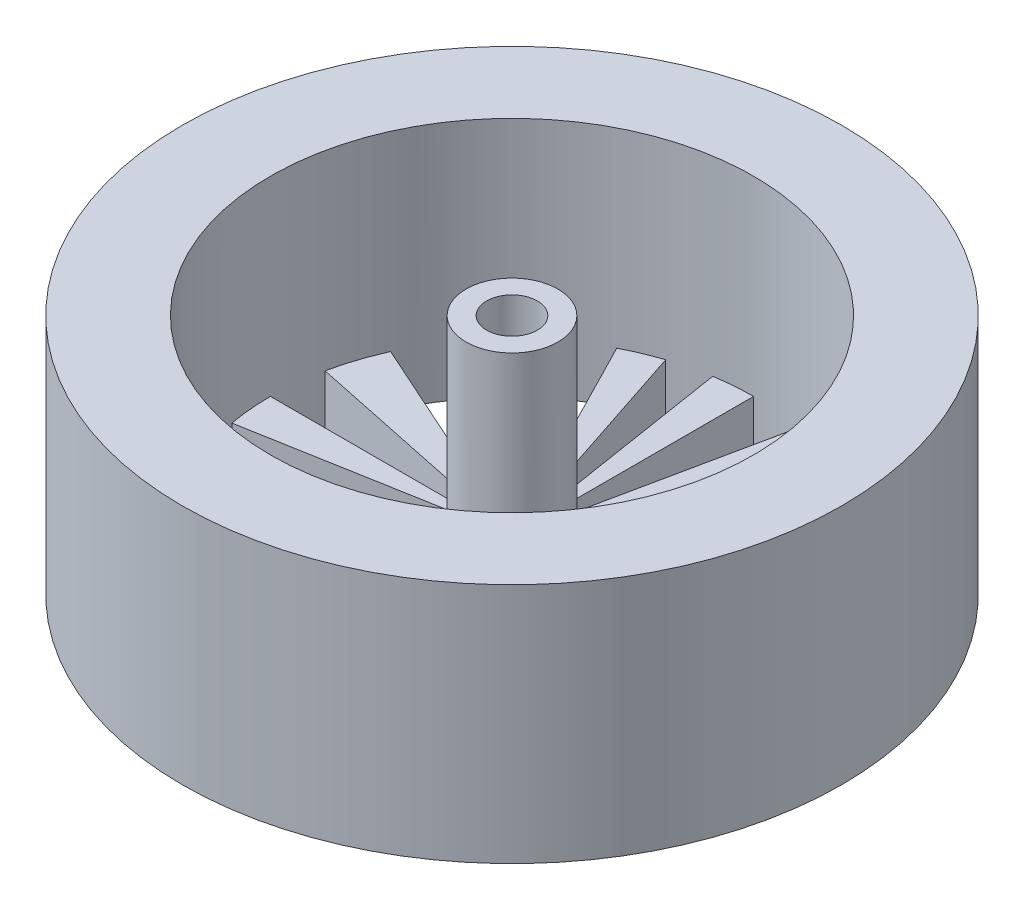
from build123d import *

# Parameters (mm, degrees)
SKETCH1_R           = 34.671
BOSS_EXTRUDE1_DEPTH = 25.4
SKETCH2_R           = 25.4
CUT_EXTRUDE1_DEPTH  = 20.066
SKETCH4_R           = 4.826
BOSS_EXTRUDE2_DEPTH = 20.066
SKETCH5_R           = 2.667
CUT_EXTRUDE2_DEPTH  = 20.066
CUT_EXTRUDE3_DEPTH  = 53.979249126


with BuildPart() as part:
    # Sketch1 → Boss-Extrude1 (new body)
    with BuildSketch(Plane(origin=(0, 0, 0), x_dir=(1, 0, 0), z_dir=(0, 1, 0))):
        with Locations(Location((0, 0, 0), (0, 0, 270))):
            Circle(SKETCH1_R)
    extrude(amount=BOSS_EXTRUDE1_DEPTH)

    # Sketch2 → Cut-Extrude1 (cut)
    with BuildSketch(Plane(origin=(0, 25.4, 0), x_dir=(1, 0, 0), z_dir=(0, 1, 0))):
        with Locations(Location((0, 0, 0), (0, 0, 270))):
            Circle(SKETCH2_R)
    extrude(amount=-CUT_EXTRUDE1_DEPTH, mode=Mode.SUBTRACT)

    # Sketch4 → Boss-Extrude2 (add)
    with BuildSketch(Plane(origin=(0, 5.334, 0), x_dir=(1, 0, 0), z_dir=(0, 1, 0))):
        with Locations(Location((0, 0, 0), (0, 0, 270))):
            Circle(SKETCH4_R)
    extrude(amount=BOSS_EXTRUDE2_DEPTH)

    # Sketch5 → Cut-Extrude2 (cut)
    with BuildSketch(Plane(origin=(0, 25.4, 0), x_dir=(1, 0, 0), z_dir=(0, 1, 0))):
        with Locations(Location((0, 0, 0), (0, 0, 270))):
            Circle(SKETCH5_R)
    extrude(amount=-CUT_EXTRUDE2_DEPTH, mode=Mode.SUBTRACT)

    # Sketch6 → Cut-Extrude3 (cut, through all)
    with BuildSketch(Plane(origin=(0, 5.334, 0), x_dir=(1, 0, 0), z_dir=(0, 1, 0))):
        with BuildLine():
            ThreePointArc((-20.672131698, 14.758826886), (-22.029333921, 12.643909483), (-23.170911404, 10.405232564))
            Line((-23.170911404, 10.405232564), (-4.402473167, 1.976994187))
            ThreePointArc((-4.402473167, 1.976994187), (-4.185573445, 2.402342802), (-3.927705023, 2.804177108))
            Line((-3.927705023, 2.804177108), (-20.672131698, 14.758826886))
        make_face()
        with BuildLine():
            Line((-15.913974648, 19.796600993), (-3.023655183, 3.761354189))
            ThreePointArc((-3.023655183, 3.761354189), (-2.626023591, 4.048984577), (-2.201236583, 4.294744871))
            Line((-2.201236583, 4.294744871), (-11.585455702, 22.603920372))
            ThreePointArc((-11.585455702, 22.603920372), (-13.821176792, 21.31044514), (-15.913974648, 19.796600993))
        make_face()
        with BuildLine():
            Line((-7.956987324, 24.121491511), (-1.511827592, 4.583083387))
            ThreePointArc((-1.511827592, 4.583083387), (-1.13757061, 4.690011632), (-0.755913796, 4.766431614))
            Line((-0.755913796, 4.766431614), (-3.978493662, 25.08648218))
            ThreePointArc((-3.978493662, 25.08648218), (-5.987213738, 24.684271747), (-7.956987324, 24.121491511))
        make_face()
        with BuildLine():
            Line((0, 25.4), (0, 4.826))
            ThreePointArc((0, 4.826), (0.496889313, 4.800351759), (0.988497094, 4.723679656))
            Line((0.988497094, 4.723679656), (5.202616282, 24.861471876))
            ThreePointArc((5.202616282, 24.861471876), (2.61520691, 25.265009258), (0, 25.4))
        make_face()
        with BuildLine():
            Line((10.405232564, 23.170911404), (1.976994187, 4.402473167))
            ThreePointArc((1.976994187, 4.402473167), (2.402342802, 4.185573445), (2.804177108, 3.927705023))
            Line((2.804177108, 3.927705023), (14.758826886, 20.672131698))
            ThreePointArc((14.758826886, 20.672131698), (12.643909483, 22.029333921), (10.405232564, 23.170911404))
        make_face()
        with BuildLine():
            Line((19.240686042, 16.581797268), (3.655730348, 3.150541481))
            ThreePointArc((3.655730348, 3.150541481), (3.93490279, 2.794068008), (4.179438599, 2.413))
            Line((4.179438599, 2.413), (21.997045256, 12.7))
            ThreePointArc((21.997045256, 12.7), (20.710014683, 14.705621097), (19.240686042, 16.581797268))
        make_face()
        with BuildLine():
            Line((23.786716405, 8.90798084), (4.519476117, 1.69251636))
            ThreePointArc((4.519476117, 1.69251636), (4.654621925, 1.274664949), (4.751223326, 0.84625818))
            Line((4.751223326, 0.84625818), (25.006438558, 4.45399042))
            ThreePointArc((25.006438558, 4.45399042), (24.498010133, 6.708762891), (23.786716405, 8.90798084))
        make_face()
        with BuildLine():
            Line((25.4, 0), (4.826, 0))
            ThreePointArc((4.826, 0), (4.800351759, -0.496889313), (4.723679656, -0.988497094))
            Line((4.723679656, -0.988497094), (24.861471876, -5.202616282))
            ThreePointArc((24.861471876, -5.202616282), (25.265009258, -2.61520691), (25.4, 0))
        make_face()
        with BuildLine():
            Line((23.170911404, -10.405232564), (4.402473167, -1.976994187))
            ThreePointArc((4.402473167, -1.976994187), (4.115324299, -2.520789939), (3.761354189, -3.023655183))
            Line((3.761354189, -3.023655183), (19.796600993, -15.913974648))
            ThreePointArc((19.796600993, -15.913974648), (21.659601572, -13.267315469), (23.170911404, -10.405232564))
        make_face()
        with BuildLine():
            Line((15.913974648, -19.796600993), (3.023655183, -3.761354189))
            ThreePointArc((3.023655183, -3.761354189), (2.626023591, -4.048984577), (2.201236583, -4.294744871))
            Line((2.201236583, -4.294744871), (11.585455702, -22.603920372))
            ThreePointArc((11.585455702, -22.603920372), (13.821176792, -21.31044514), (15.913974648, -19.796600993))
        make_face()
        with BuildLine():
            Line((7.956987324, -24.121491511), (1.511827592, -4.583083387))
            ThreePointArc((1.511827592, -4.583083387), (1.00639234, -4.719899412), (0.489109394, -4.801150695))
            Line((0.489109394, -4.801150695), (2.574259969, -25.269214187))
            ThreePointArc((2.574259969, -25.269214187), (5.296801792, -24.841575851), (7.956987324, -24.121491511))
        make_face()
        with BuildLine():
            Line((0, -25.4), (0, -4.826))
            ThreePointArc((0, -4.826), (-0.496889313, -4.800351759), (-0.988497094, -4.723679656))
            Line((-0.988497094, -4.723679656), (-5.202616282, -24.861471876))
            ThreePointArc((-5.202616282, -24.861471876), (-2.61520691, -25.265009258), (0, -25.4))
        make_face()
        with BuildLine():
            Line((-10.405232564, -23.170911404), (-1.976994187, -4.402473167))
            ThreePointArc((-1.976994187, -4.402473167), (-2.520789939, -4.115324299), (-3.023655183, -3.761354189))
            Line((-3.023655183, -3.761354189), (-15.913974648, -19.796600993))
            ThreePointArc((-15.913974648, -19.796600993), (-13.267315469, -21.659601572), (-10.405232564, -23.170911404))
        make_face()
        with BuildLine():
            Line((-19.240686042, -16.581797268), (-3.655730348, -3.150541481))
            ThreePointArc((-3.655730348, -3.150541481), (-3.93490279, -2.794068008), (-4.179438599, -2.413))
            Line((-4.179438599, -2.413), (-21.997045256, -12.7))
            ThreePointArc((-21.997045256, -12.7), (-20.710014683, -14.705621097), (-19.240686042, -16.581797268))
        make_face()
        with BuildLine():
            Line((-4.751223326, -0.84625818), (-25.006438558, -4.45399042))
            ThreePointArc((-25.006438558, -4.45399042), (-24.498010133, -6.708762891), (-23.786716405, -8.90798084))
            Line((-23.786716405, -8.90798084), (-4.519476117, -1.69251636))
            ThreePointArc((-4.519476117, -1.69251636), (-4.654621925, -1.274664949), (-4.751223326, -0.84625818))
        make_face()
        with BuildLine():
            ThreePointArc((-24.861471876, 5.202616282), (-25.265009258, 2.61520691), (-25.4, 0))
            Line((-25.4, 0), (-4.826, 0))
            ThreePointArc((-4.826, 0), (-4.800351759, 0.496889313), (-4.723679656, 0.988497094))
            Line((-4.723679656, 0.988497094), (-24.861471876, 5.202616282))
        make_face()
    extrude(amount=-CUT_EXTRUDE3_DEPTH, mode=Mode.SUBTRACT)


solid = part.part
